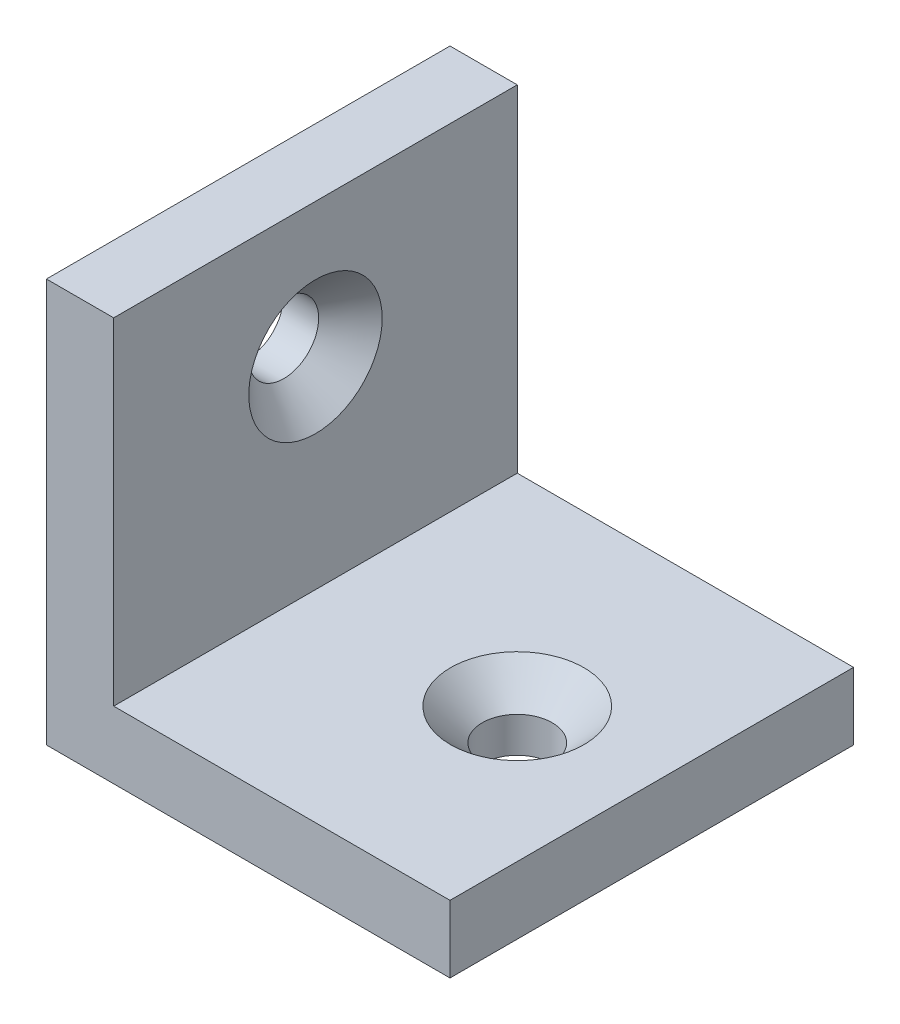
from build123d import *

# Parameters (mm, degrees)
BOSS_EXTRUDE1_DEPTH                             = 19.05
CSK_FOR_M6_FLAT_HEAD_MACHINE_SCREW1_D           = 6.6
CSK_FOR_M6_FLAT_HEAD_MACHINE_SCREW1_CSINK_D     = 12.6
CSK_FOR_M6_FLAT_HEAD_MACHINE_SCREW1_CSINK_ANGLE = 90
CSK_FOR_M6_FLAT_HEAD_MACHINE_SCREW2_D           = 6.6
CSK_FOR_M6_FLAT_HEAD_MACHINE_SCREW2_CSINK_D     = 12.6
CSK_FOR_M6_FLAT_HEAD_MACHINE_SCREW2_CSINK_ANGLE = 90


with BuildPart() as part:
    # Sketch1 → Boss-Extrude1 (new, symmetric)
    with BuildSketch(Plane.XY):
        Polygon((0, 4.567772054), (0, 0), (4.567772054, 0), (38.1, 0), (38.1, 6.35), (6.35, 6.35), (6.35, 38.1), (0, 38.1), align=None)
    extrude(amount=BOSS_EXTRUDE1_DEPTH, both=True)

    # CSK for M6 Flat Head Machine Screw1 (through all)
    with Locations(Plane(origin=(6.35, 0, 0), x_dir=(0, 0, -1), z_dir=(1, 0, 0))):
        with Locations((0, 25.4)):
            CounterSinkHole(CSK_FOR_M6_FLAT_HEAD_MACHINE_SCREW1_D / 2, CSK_FOR_M6_FLAT_HEAD_MACHINE_SCREW1_CSINK_D / 2, counter_sink_angle=CSK_FOR_M6_FLAT_HEAD_MACHINE_SCREW1_CSINK_ANGLE)

    # CSK for M6 Flat Head Machine Screw2 (through all)
    with Locations(Plane(origin=(0, 6.35, 0), x_dir=(1, 0, 0), z_dir=(0, 1, 0))):
        with Locations((25.4, 0)):
            CounterSinkHole(CSK_FOR_M6_FLAT_HEAD_MACHINE_SCREW2_D / 2, CSK_FOR_M6_FLAT_HEAD_MACHINE_SCREW2_CSINK_D / 2, counter_sink_angle=CSK_FOR_M6_FLAT_HEAD_MACHINE_SCREW2_CSINK_ANGLE)


solid = part.part
